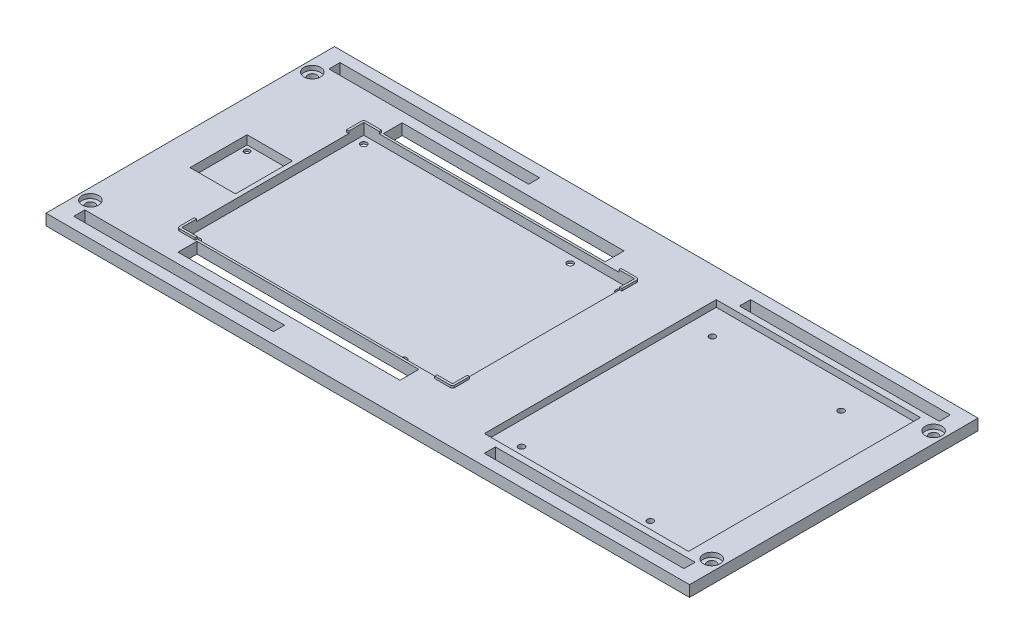
from build123d import *

# Parameters (mm, degrees)
CROQUIS2_W              = 290
CROQUIS2_H              = 130
SALIENTE_EXTRUIR1_DEPTH = 5
CROQUIS3_W              = 90
CROQUIS3_H              = 5
CORTAR_EXTRUIR1_DEPTH   = 159.981130956
CROQUIS4_W              = 20.5
CROQUIS4_H              = 25.7
CORTAR_EXTRUIR2_DEPTH   = 4
CROQUIS5_R              = 1.25
CORTAR_EXTRUIR3_DEPTH   = 4
CROQUIS6_W              = 92
CROQUIS6_H              = 104.5
CORTAR_EXTRUIR4_DEPTH   = 3
CROQUIS7_W              = 100
CROQUIS7_H              = 8.5
CORTAR_EXTRUIR5_DEPTH   = 159.981130956
CROQUIS8_R              = 2
CORTAR_EXTRUIR6_DEPTH   = 159.981130956
CROQUIS9_R              = 3.75
CORTAR_EXTRUIR7_DEPTH   = 2
CROQUIS10_W             = 122
CROQUIS10_H             = 82
CORTAR_EXTRUIR8_DEPTH   = 4
CROQUIS13_R             = 1.4
CORTAR_EXTRUIR9_DEPTH   = 3
CROQUIS14_R             = 1.4
CORTAR_EXTRUIR10_DEPTH  = 3
SALIENTE_EXTRUIR2_DEPTH = 1
CROQUIS16_R             = 1.375
CORTAR_EXTRUIR11_DEPTH  = 159.95282319


with BuildPart() as part:
    # Croquis2 → Saliente-Extruir1 (new body)
    with BuildSketch(Plane(origin=(0, 0, 0), x_dir=(1, 0, 0), z_dir=(0, 1, 0))):
        Rectangle(CROQUIS2_W, CROQUIS2_H)
    extrude(amount=SALIENTE_EXTRUIR1_DEPTH)

    # Croquis3 → Cortar-Extruir1 (cut, through all)
    with BuildSketch(Plane(origin=(0, 5, 0), x_dir=(1, 0, 0), z_dir=(0, 1, 0))):
        with Locations((92.5, -57.5)):
            Rectangle(CROQUIS3_W, CROQUIS3_H)
        with Locations((-92.5, -57.5)):
            Rectangle(CROQUIS3_W, CROQUIS3_H)
        with Locations((92.5, 57.5)):
            Rectangle(CROQUIS3_W, CROQUIS3_H)
        with Locations((-92.5, 57.5)):
            Rectangle(CROQUIS3_W, CROQUIS3_H)
    extrude(amount=-CORTAR_EXTRUIR1_DEPTH, mode=Mode.SUBTRACT)

    # Croquis4 → Cortar-Extruir2 (cut)
    with BuildSketch(Plane(origin=(0, 5, 0), x_dir=(1, 0, 0), z_dir=(0, 1, 0))):
        with Locations((-120.05, -1.95)):
            Rectangle(CROQUIS4_W, CROQUIS4_H)
    extrude(amount=-CORTAR_EXTRUIR2_DEPTH, mode=Mode.SUBTRACT)

    # Croquis5 → Cortar-Extruir3 (cut)
    with BuildSketch(Plane(origin=(0, 1, 0), x_dir=(1, 0, 0), z_dir=(0, 1, 0))):
        with Locations(Location((-127.8, 8.4, 0), (0, 0, 270))):
            Circle(CROQUIS5_R)
        with Locations(Location((-112.3, 8.4, 0), (0, 0, 90))):
            Circle(CROQUIS5_R)
        with Locations(Location((-112.3, -12.3, 0), (0, 0, 270))):
            Circle(CROQUIS5_R)
        with Locations(Location((-127.8, -12.3, 0), (0, 0, 90))):
            Circle(CROQUIS5_R)
    extrude(amount=-CORTAR_EXTRUIR3_DEPTH, mode=Mode.SUBTRACT)

    # Croquis6 → Cortar-Extruir4 (cut)
    with BuildSketch(Plane(origin=(0, 5, 0), x_dir=(1, 0, 0), z_dir=(0, 1, 0))):
        with Locations((85.8, 0)):
            Rectangle(CROQUIS6_W, CROQUIS6_H)
    extrude(amount=-CORTAR_EXTRUIR4_DEPTH, mode=Mode.SUBTRACT)

    # Croquis7 → Cortar-Extruir5 (cut, through all)
    with BuildSketch(Plane(origin=(0, 5, 0), x_dir=(1, 0, 0), z_dir=(0, 1, 0))):
        with Locations((-50, -46.25)):
            Rectangle(CROQUIS7_W, CROQUIS7_H)
        with Locations((-50, 46.25)):
            Rectangle(CROQUIS7_W, CROQUIS7_H)
    extrude(amount=-CORTAR_EXTRUIR5_DEPTH, mode=Mode.SUBTRACT)

    # Croquis8 → Cortar-Extruir6 (cut, through all)
    with BuildSketch(Plane(origin=(0, 5, 0), x_dir=(1, 0, 0), z_dir=(0, 1, 0))):
        with Locations(Location((-140, 50, 0), (0, 0, 270))):
            Circle(CROQUIS8_R)
        with Locations(Location((140, 50, 0), (0, 0, 90))):
            Circle(CROQUIS8_R)
        with Locations(Location((140, -50, 0), (0, 0, 270))):
            Circle(CROQUIS8_R)
        with Locations(Location((-140, -50, 0), (0, 0, 90))):
            Circle(CROQUIS8_R)
    extrude(amount=-CORTAR_EXTRUIR6_DEPTH, mode=Mode.SUBTRACT)

    # Croquis9 → Cortar-Extruir7 (cut)
    with BuildSketch(Plane(origin=(0, 5, 0), x_dir=(1, 0, 0), z_dir=(0, 1, 0))):
        with Locations(Location((-140, 50, 0), (0, 0, 270))):
            Circle(CROQUIS9_R)
        with Locations(Location((-140, -50, 0), (0, 0, 90))):
            Circle(CROQUIS9_R)
        with Locations(Location((140, -50, 0), (0, 0, 270))):
            Circle(CROQUIS9_R)
        with Locations(Location((140, 50, 0), (0, 0, 90))):
            Circle(CROQUIS9_R)
    extrude(amount=-CORTAR_EXTRUIR7_DEPTH, mode=Mode.SUBTRACT)

    # Croquis10 → Cortar-Extruir8 (cut)
    with BuildSketch(Plane(origin=(0, 5, 0), x_dir=(1, 0, 0), z_dir=(0, 1, 0))):
        with Locations((-46.8, 0)):
            Rectangle(CROQUIS10_W, CROQUIS10_H)
    extrude(amount=-CORTAR_EXTRUIR8_DEPTH, mode=Mode.SUBTRACT)

    # Croquis13 → Cortar-Extruir9 (cut)
    with BuildSketch(Plane(origin=(0, 1, 0), x_dir=(1, 0, 0), z_dir=(0, 1, 0))):
        with Locations(Location((-104.3, 37.5, 0), (0, 0, 270))):
            Circle(CROQUIS13_R)
        with Locations(Location((10.7, 37.5, 0), (0, 0, 90))):
            Circle(CROQUIS13_R)
        with Locations(Location((10.7, -37.5, 0), (0, 0, 270))):
            Circle(CROQUIS13_R)
        with Locations(Location((-104.3, -37.5, 0), (0, 0, 90))):
            Circle(CROQUIS13_R)
    extrude(amount=-CORTAR_EXTRUIR9_DEPTH, mode=Mode.SUBTRACT)

    # Croquis14 → Cortar-Extruir10 (cut)
    with BuildSketch(Plane(origin=(0, 1, 0), x_dir=(1, 0, 0), z_dir=(0, 1, 0))):
        with Locations(Location((-104.3, -37.5, 0), (0, 0, 90))):
            Circle(CROQUIS14_R)
        with Locations(Location((-104.3, 37.5, 0), (0, 0, 270))):
            Circle(CROQUIS14_R)
        with Locations(Location((-11.3, 37.5, 0), (0, 0, 90))):
            Circle(CROQUIS14_R)
        with Locations(Location((-11.3, -37.5, 0), (0, 0, 90))):
            Circle(CROQUIS14_R)
    extrude(amount=-CORTAR_EXTRUIR10_DEPTH, mode=Mode.SUBTRACT)

    # Croquis15 → Saliente-Extruir2 (add)
    with BuildSketch(Plane(origin=(0, 5, 0), x_dir=(1, 0, 0), z_dir=(0, 1, 0))):
        with BuildLine():
            Line((-107.8, 42), (-100.783894533, 42))
            Line((-100.783894533, 42), (-100.783894533, 41))
            Line((-100.783894533, 41), (-107.8, 41))
            Line((-107.8, 41), (-107.8, 34.318360621))
            Line((-107.8, 34.318360621), (-108.8, 34.318360621))
            Line((-108.8, 34.318360621), (-108.8, 41))
            ThreePointArc((-108.8, 41), (-108.507106781, 41.707106781), (-107.8, 42))
        make_face()
        with BuildLine():
            Line((15.2, 41), (15.2, 34.318360621))
            Line((15.2, 34.318360621), (14.2, 34.318360621))
            Line((14.2, 34.318360621), (14.2, 41))
            Line((14.2, 41), (7.183894533, 41))
            Line((7.183894533, 41), (7.183894533, 42))
            Line((7.183894533, 42), (14.2, 42))
            ThreePointArc((14.2, 42), (14.907106781, 41.707106781), (15.2, 41))
        make_face()
        with BuildLine():
            Line((14.2, -42), (7.183894533, -42))
            Line((7.183894533, -42), (7.183894533, -41))
            Line((7.183894533, -41), (14.2, -41))
            Line((14.2, -41), (14.2, -34.318360621))
            Line((14.2, -34.318360621), (15.2, -34.318360621))
            Line((15.2, -34.318360621), (15.2, -41))
            ThreePointArc((15.2, -41), (14.907106781, -41.707106781), (14.2, -42))
        make_face()
        with BuildLine():
            Line((-108.8, -41), (-108.8, -34.318360621))
            Line((-108.8, -34.318360621), (-107.8, -34.318360621))
            Line((-107.8, -34.318360621), (-107.8, -41))
            Line((-107.8, -41), (-100.783894533, -41))
            Line((-100.783894533, -41), (-100.783894533, -42))
            Line((-100.783894533, -42), (-107.8, -42))
            ThreePointArc((-107.8, -42), (-108.507106781, -41.707106781), (-108.8, -41))
        make_face()
    extrude(amount=SALIENTE_EXTRUIR2_DEPTH)

    # Croquis16 → Cortar-Extruir11 (cut, through all)
    with BuildSketch(Plane(origin=(0, 2, 0), x_dir=(1, 0, 0), z_dir=(0, 1, 0))):
        with Locations(Location((50.3, 40, 0), (0, 0, 270))):
            Circle(CROQUIS16_R)
        with Locations(Location((50.3, -46, 0), (0, 0, 270))):
            Circle(CROQUIS16_R)
        with Locations(Location((108.3, 40, 0), (0, 0, 270))):
            Circle(CROQUIS16_R)
        with Locations(Location((108.3, -46, 0), (0, 0, 270))):
            Circle(CROQUIS16_R)
    extrude(amount=-CORTAR_EXTRUIR11_DEPTH, mode=Mode.SUBTRACT)


solid = part.part
